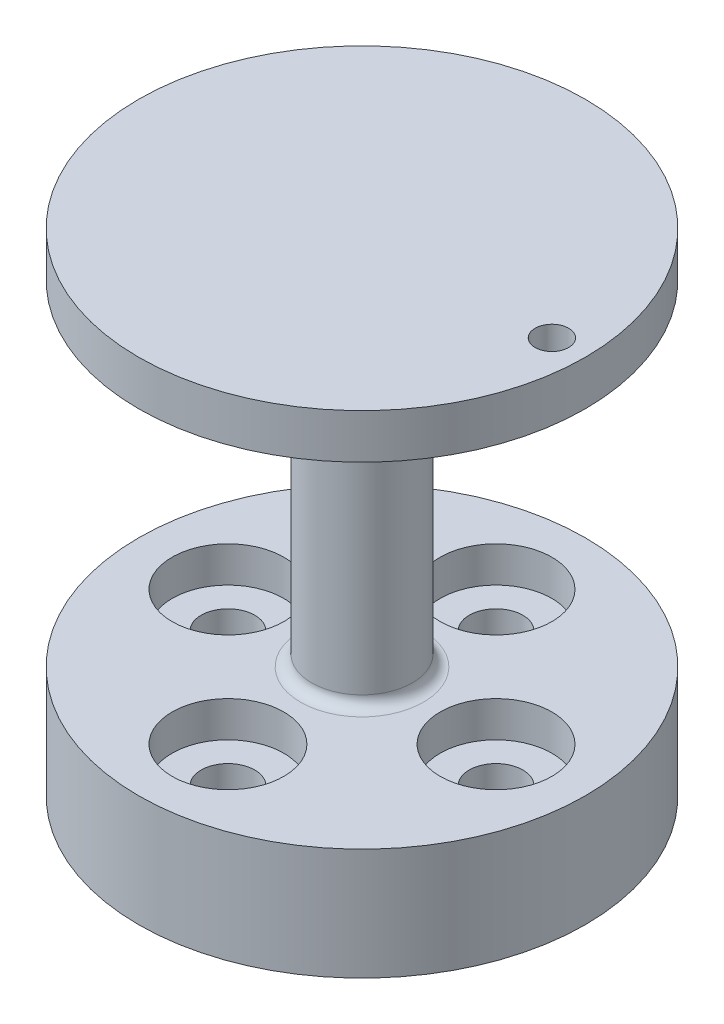
from build123d import *

# Parameters (mm, degrees)
SKETCH1_R                                = 10
BOTTOM_DEPTH                             = 5
CBORE_FOR_M2_PAN_HEAD_SCREW1_D           = 2.4
CBORE_FOR_M2_PAN_HEAD_SCREW1_CBORE_D     = 5
CBORE_FOR_M2_PAN_HEAD_SCREW1_CBORE_DEPTH = 1.6
SKETCH4_R                                = 2.25
GROOVE_DEPTH                             = 15
CIRPATTERN1_COUNT                        = 4
FILLET1_R                                = 0.5
SKETCH7_R                                = 10
TOP_DEPTH                                = 2
SKETCH8_R                                = 0.75
THREAD_TERMINAL_DEPTH                    = 2
FILLET2_R                                = 5


with BuildPart() as part:
    # Sketch1 → bottom (new body)
    with BuildSketch(Plane(origin=(0, 0, 0), x_dir=(1, 0, 0), z_dir=(0, 1, 0))):
        with Locations(Location((0, 0, 0), (0, 0, 270))):
            Circle(SKETCH1_R)
    extrude(amount=BOTTOM_DEPTH)

    # CBORE for M2 Pan Head Screw1 (through all)
    with Locations(Plane(origin=(0, 5, 0), x_dir=(1, 0, 0), z_dir=(0, 1, 0))):
        with Locations((6, 0)):
            cbore_for_m2_pan_head_screw1 = CounterBoreHole(CBORE_FOR_M2_PAN_HEAD_SCREW1_D / 2, CBORE_FOR_M2_PAN_HEAD_SCREW1_CBORE_D / 2, CBORE_FOR_M2_PAN_HEAD_SCREW1_CBORE_DEPTH)

    # Sketch4 → groove (add)
    with BuildSketch(Plane(origin=(0, 5, 0), x_dir=(1, 0, 0), z_dir=(0, 1, 0))):
        with Locations(Location((0, 0, 0), (0, 0, 270))):
            Circle(SKETCH4_R)
    extrude(amount=GROOVE_DEPTH)

    # CirPattern1: CBORE for M2 Pan Head Screw1 ×4 about axis
    cirpattern1_axis = Axis((0, 0, 0), (0, 1, 0))
    for i in range(1, CIRPATTERN1_COUNT):
        add(cbore_for_m2_pan_head_screw1.rotate(cirpattern1_axis, i * 360 / CIRPATTERN1_COUNT), mode=Mode.SUBTRACT)

    # Fillet1
    fillet1_edges = [part.edges().sort_by_distance(p)[0] for p in [
        (0, 5, -2.25),
    ]]
    fillet(fillet1_edges, radius=FILLET1_R)

    # Sketch7 → top (add)
    with BuildSketch(Plane(origin=(0, 20, 0), x_dir=(1, 0, 0), z_dir=(0, 1, 0))):
        with Locations(Location((0, 0, 0), (0, 0, 270))):
            Circle(SKETCH7_R)
    extrude(amount=TOP_DEPTH)

    # Sketch8 → thread_terminal (cut)
    with BuildSketch(Plane(origin=(0, 22, 0), x_dir=(1, 0, 0), z_dir=(0, 1, 0))):
        with Locations(Location((8.5, 0, 0), (0, 0, 270))):
            Circle(SKETCH8_R)
    extrude(amount=-THREAD_TERMINAL_DEPTH, mode=Mode.SUBTRACT)

    # Fillet2
    fillet2_edges = [part.edges().sort_by_distance(p)[0] for p in [
        (0, 20, -2.25),
    ]]
    fillet(fillet2_edges, radius=FILLET2_R)


solid = part.part
